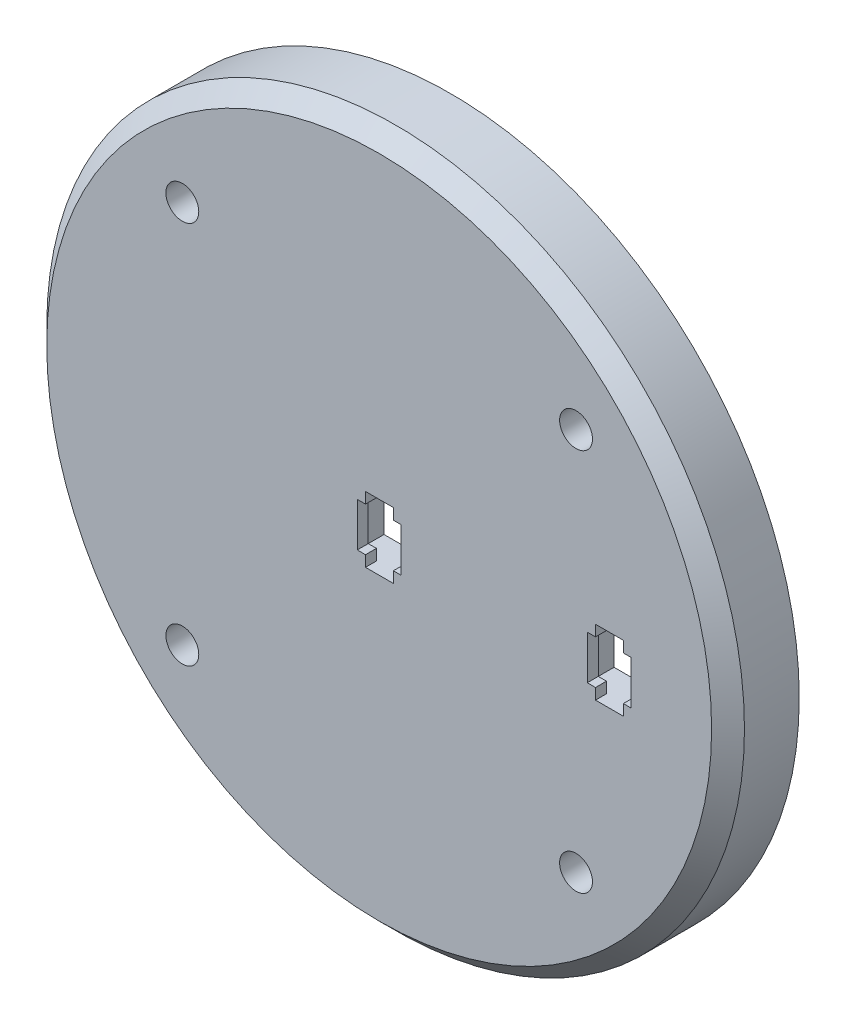
from build123d import *

# Parameters (mm, degrees)
SKETCH2_R           = 31.85
BOSS_EXTRUDE1_DEPTH = 6.5
SKETCH3_W           = 6
SKETCH3_H           = 6
CUT_EXTRUDE1_DEPTH  = 6.5
CHAMFER1_SIZE       = 6
CHAMFER1_SIZE2      = 3.057152697
SKETCH5_R           = 1.5
CUT_EXTRUDE2_DEPTH  = 56.252556502
SKETCH6_R           = 2.5
CUT_EXTRUDE3_DEPTH  = 3
CHAMFER3_SIZE       = 1.5
BOSS_EXTRUDE2_DEPTH = 1


with BuildPart() as part:
    # Sketch2 → Boss-Extrude1 (new body)
    with BuildSketch(Plane.XY.offset(-25.5)):
        Circle(SKETCH2_R)
    extrude(amount=-BOSS_EXTRUDE1_DEPTH)

    # Sketch3 → Cut-Extrude1 (cut)
    with BuildSketch(Plane(origin=(0, 0, -32), x_dir=(-1, 0, 0), z_dir=(0, 0, -1))):
        with Locations((-21, 0)):
            Rectangle(SKETCH3_W, SKETCH3_H)
        Rectangle(SKETCH3_W, SKETCH3_H)
    extrude(amount=-CUT_EXTRUDE1_DEPTH, mode=Mode.SUBTRACT)

    # Chamfer1
    chamfer1_edges = [part.edges().sort_by_distance(p)[0] for p in [
        (3, 0, -32),
        (0, -3, -32),
        (-3, 0, -32),
        (0, 3, -32),
        (24, 0, -32),
        (21, -3, -32),
        (18, 0, -32),
        (21, 3, -32),
    ]]
    chamfer1_side = [part.faces().sort_by_distance(p)[0] for p in [
        (-30.949145961, 0, -32),
    ]]
    chamfer(chamfer1_edges, length=CHAMFER1_SIZE, length2=CHAMFER1_SIZE2, reference=chamfer1_side[0])

    # Sketch5 → Cut-Extrude2 (cut, through all)
    with BuildSketch(Plane.XY):
        with Locations((-17.971861544, -17.500238124)):
            Circle(SKETCH5_R)
        with Locations((17.971861544, -17.500238124)):
            Circle(SKETCH5_R)
        with Locations((17.971861544, 17.500238124)):
            Circle(SKETCH5_R)
        with Locations((-17.971861544, 17.500238124)):
            Circle(SKETCH5_R)
    extrude(amount=-CUT_EXTRUDE2_DEPTH, mode=Mode.SUBTRACT)

    # Sketch6 → Cut-Extrude3 (cut)
    with BuildSketch(Plane.XY.offset(-32)):
        with Locations((-17.971861544, -17.500238124)):
            Circle(SKETCH6_R)
        with Locations(Location((17.971861544, -17.500238124, 0), (0, 0, 180))):
            Circle(SKETCH6_R)
        with Locations((17.971861544, 17.500238124)):
            Circle(SKETCH6_R)
        with Locations(Location((-17.971861544, 17.500238124, 0), (0, 0, 180))):
            Circle(SKETCH6_R)
    extrude(amount=CUT_EXTRUDE3_DEPTH, mode=Mode.SUBTRACT)

    # Chamfer3
    chamfer3_edges = [part.edges().sort_by_distance(p)[0] for p in [
        (-31.85, 0, -25.5),
    ]]
    chamfer(chamfer3_edges, length=CHAMFER3_SIZE)

    # Sketch7 → Boss-Extrude2 (add)
    with BuildSketch(Plane.XY.offset(-25.5)):
        Polygon((-1.25, -2), (-2, -2), (-2, 2), (-1.25, 2), (-1.25, 3), (-3, 3), (-3, -3), (-1.25, -3), align=None)
        Polygon((1.2909118, -3), (3, -3), (3, 3), (1.2909118, 3), (1.2909118, 2), (2, 2), (2, -2), (1.2909118, -2), align=None)
        Polygon((19.75, -2), (19, -2), (19, 2), (19.75, 2), (19.75, 3), (18, 3), (18, -3), (19.75, -3), align=None)
        Polygon((22.2909118, -3), (24, -3), (24, 3), (22.2909118, 3), (22.2909118, 2), (23, 2), (23, -2), (22.2909118, -2), align=None)
    extrude(amount=-BOSS_EXTRUDE2_DEPTH)


solid = part.part
